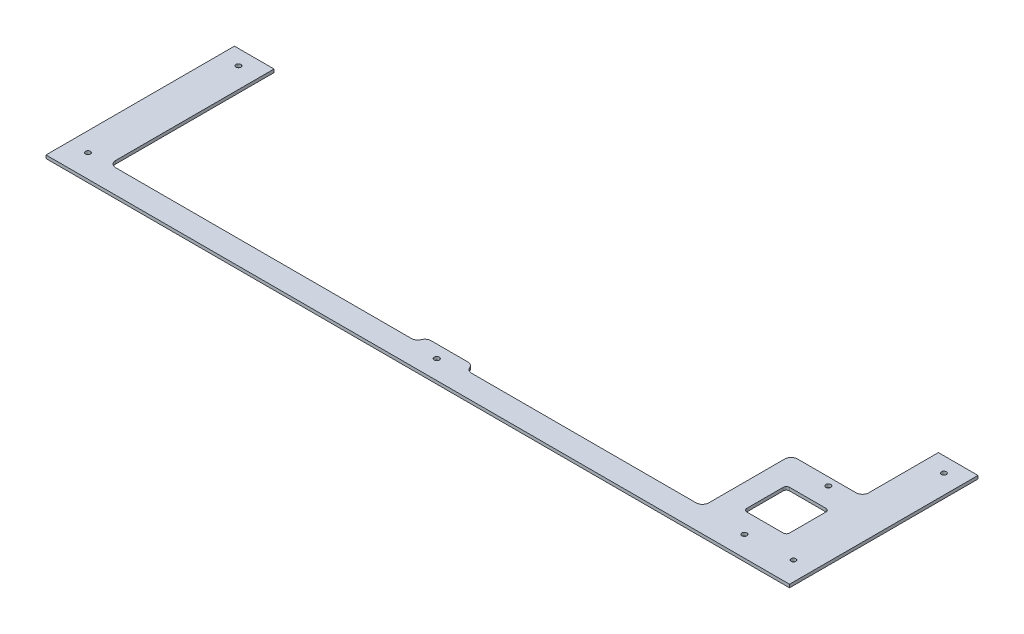
from build123d import *

# Parameters (mm, degrees)
CROQUIS1_W              = 470.5
CROQUIS1_H              = 120
CROQUIS1_R              = 1.55
SALIENTE_EXTRUIR1_DEPTH = 2
CROQUIS2_W              = 470.5
CROQUIS2_H              = 120
CROQUIS2_W_2            = 469.5
CROQUIS2_H_2            = 119
CORTAR_EXTRUIR1_DEPTH   = 2
CROQUIS3_R              = 1.6
CORTAR_EXTRUIR2_DEPTH   = 2
CROQUIS4_R              = 1.6
CROQUIS4_W              = 27
CROQUIS4_H              = 27
CORTAR_EXTRUIR3_DEPTH   = 2
REDONDEO1_R             = 2
CORTAR_EXTRUIR4_DEPTH   = 2
REDONDEO2_R             = 4
REDONDEO3_R             = 4


with BuildPart() as part:
    # Croquis1 → Saliente-Extruir1 (new body)
    with BuildSketch(Plane(origin=(0, 0, 0), x_dir=(1, 0, 0), z_dir=(0, 1, 0))):
        with Locations((235.25, 60)):
            Rectangle(CROQUIS1_W, CROQUIS1_H)
        with Locations(Location((12.5, 15, 0), (0, 0, 270))):
            Circle(CROQUIS1_R, mode=Mode.SUBTRACT)
        with Locations(Location((12.5, 110, 0), (0, 0, 270))):
            Circle(CROQUIS1_R, mode=Mode.SUBTRACT)
        with Locations(Location((458, 15, 0), (0, 0, 90))):
            Circle(CROQUIS1_R, mode=Mode.SUBTRACT)
        with Locations(Location((458, 110, 0), (0, 0, 90))):
            Circle(CROQUIS1_R, mode=Mode.SUBTRACT)
    extrude(amount=SALIENTE_EXTRUIR1_DEPTH)

    # Croquis2 → Cortar-Extruir1 (cut)
    with BuildSketch(Plane.XZ):
        with Locations((235.25, -60)):
            Rectangle(CROQUIS2_W, CROQUIS2_H)
        with Locations((235.25, -60)):
            Rectangle(CROQUIS2_W_2, CROQUIS2_H_2, mode=Mode.SUBTRACT)
    extrude(amount=-CORTAR_EXTRUIR1_DEPTH, mode=Mode.SUBTRACT)

    # Croquis3 → Cortar-Extruir2 (cut)
    with BuildSketch(Plane.XZ):
        with Locations(Location((235.25, -12.5, 0), (0, 0, 270))):
            Circle(CROQUIS3_R)
    extrude(amount=-CORTAR_EXTRUIR2_DEPTH, mode=Mode.SUBTRACT)

    # Croquis4 → Cortar-Extruir3 (cut)
    with BuildSketch(Plane.XZ):
        with Locations(Location((428.5, -66.5, 0), (0, 0, 270))):
            Circle(CROQUIS4_R)
        with Locations(Location((428.5, -13.5, 0), (0, 0, 270))):
            Circle(CROQUIS4_R)
        with Locations((428.5, -40)):
            Rectangle(CROQUIS4_W, CROQUIS4_H)
    extrude(amount=-CORTAR_EXTRUIR3_DEPTH, mode=Mode.SUBTRACT)

    # Redondeo1
    redondeo1_edges = [part.edges().sort_by_distance(p)[0] for p in [
        (415, 1, -53.5),
        (442, 1, -53.5),
        (442, 1, -26.5),
        (415, 1, -26.5),
    ]]
    fillet(redondeo1_edges, radius=REDONDEO1_R)

    # Croquis5 → Cortar-Extruir4 (cut)
    with BuildSketch(Plane.XZ):
        Polygon((25.5, -119.5), (25.5, -15.5), (220.25, -15.5), (220.25, -20.5), (250.25, -20.5), (250.25, -15.5), (400, -15.5), (400, -71.5), (445, -71.5), (445, -119.5), align=None)
    extrude(amount=-CORTAR_EXTRUIR4_DEPTH, mode=Mode.SUBTRACT)

    # Redondeo2
    redondeo2_edges = [part.edges().sort_by_distance(p)[0] for p in [
        (25.5, 1, -15.5),
        (220.25, 1, -15.5),
        (250.25, 1, -15.5),
        (400, 1, -15.5),
        (400, 1, -71.5),
        (445, 1, -71.5),
    ]]
    fillet(redondeo2_edges, radius=REDONDEO2_R)

    # Redondeo3
    redondeo3_edges = [part.edges().sort_by_distance(p)[0] for p in [
        (220.25, 1, -20.5),
        (250.25, 1, -20.5),
    ]]
    fillet(redondeo3_edges, radius=REDONDEO3_R)


solid = part.part
